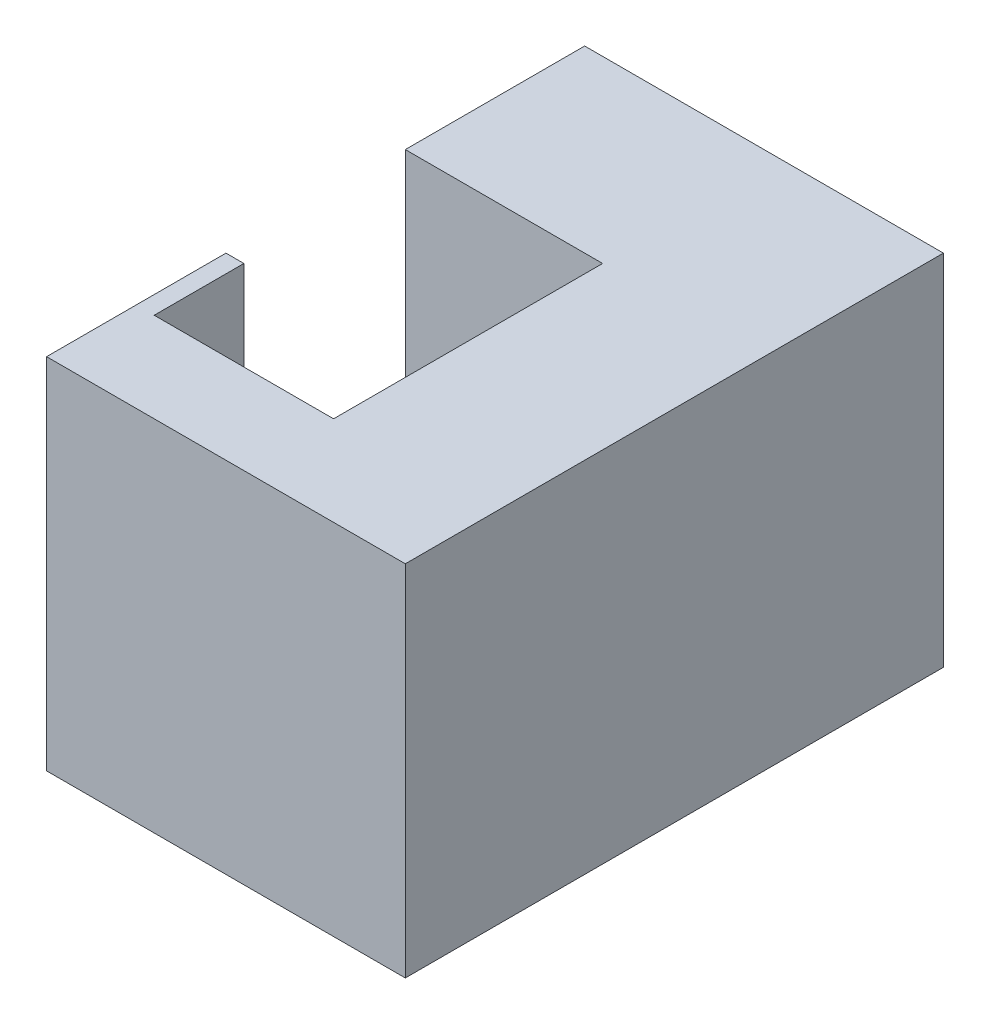
from build123d import *

# Parameters (mm, degrees)
SKETCH2_W               = 5
SKETCH2_H               = 7.5
BOSS_EXTRUDE1_DEPTH     = 5
CUT_EXTRUDE1_DEPTH      = 7.731456009
CUT_EXTRUDE1_DEPTH_BACK = 5


with BuildPart() as part:
    # Sketch2 → Boss-Extrude1 (new body)
    with BuildSketch(Plane(origin=(0, 0, 0), x_dir=(1, 0, 0), z_dir=(0, 1, 0))):
        Rectangle(SKETCH2_W, SKETCH2_H)
    extrude(amount=BOSS_EXTRUDE1_DEPTH)

    # Sketch3 → Cut-Extrude1 (cut, two sides: drawn at the far end of the back side and taken through both)
    with BuildSketch(Plane.XZ.offset(-CUT_EXTRUDE1_DEPTH_BACK)):
        Polygon((-26.642135624, -1.25), (-2.5, -1.25), (0.25, -1.25), (0.25, 2.5), (-2.25, 2.5), (-2.25, 1.25), (-2.5, 1.25), (-26.642135624, 1.25), (-74.926406871, 1.25), (-74.926406871, -1.25), align=None)
    extrude(amount=CUT_EXTRUDE1_DEPTH + CUT_EXTRUDE1_DEPTH_BACK, mode=Mode.SUBTRACT)


solid = part.part
